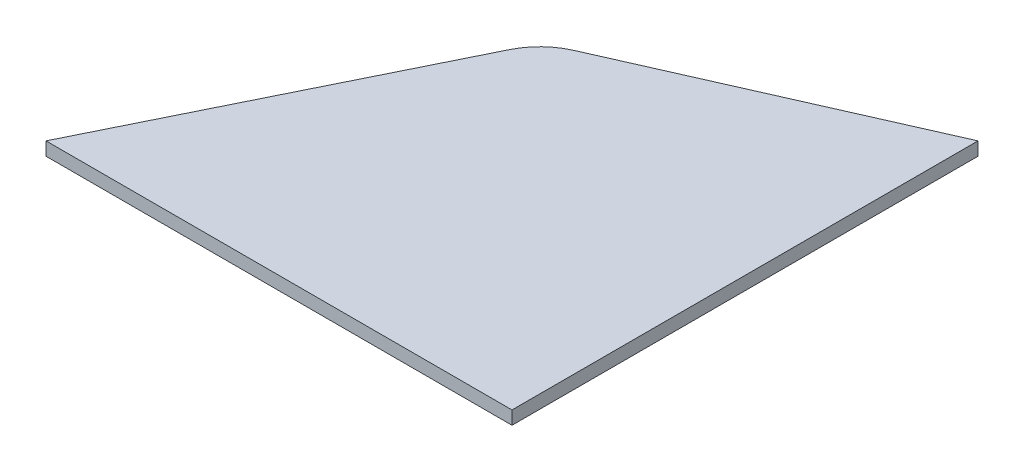
from build123d import *

# Parameters (mm, degrees)
RESSALTO_EXTRUS_O1_DEPTH = 2
FILETE1_R                = 10


with BuildPart() as part:
    # Esboço1 → Ressalto-extrusão1 (new body)
    with BuildSketch(Plane(origin=(0, 0, 0), x_dir=(1, 0, 0), z_dir=(0, 1, 0))):
        Polygon((0, 0), (70, 0), (70, 70), (24.544299076, 49.952139866), align=None)
    extrude(amount=RESSALTO_EXTRUS_O1_DEPTH)

    # Filete1
    filete1_edges = [part.edges().sort_by_distance(p)[0] for p in [
        (24.544299076, 1, -49.952139866),
    ]]
    fillet(filete1_edges, radius=FILETE1_R)


solid = part.part
